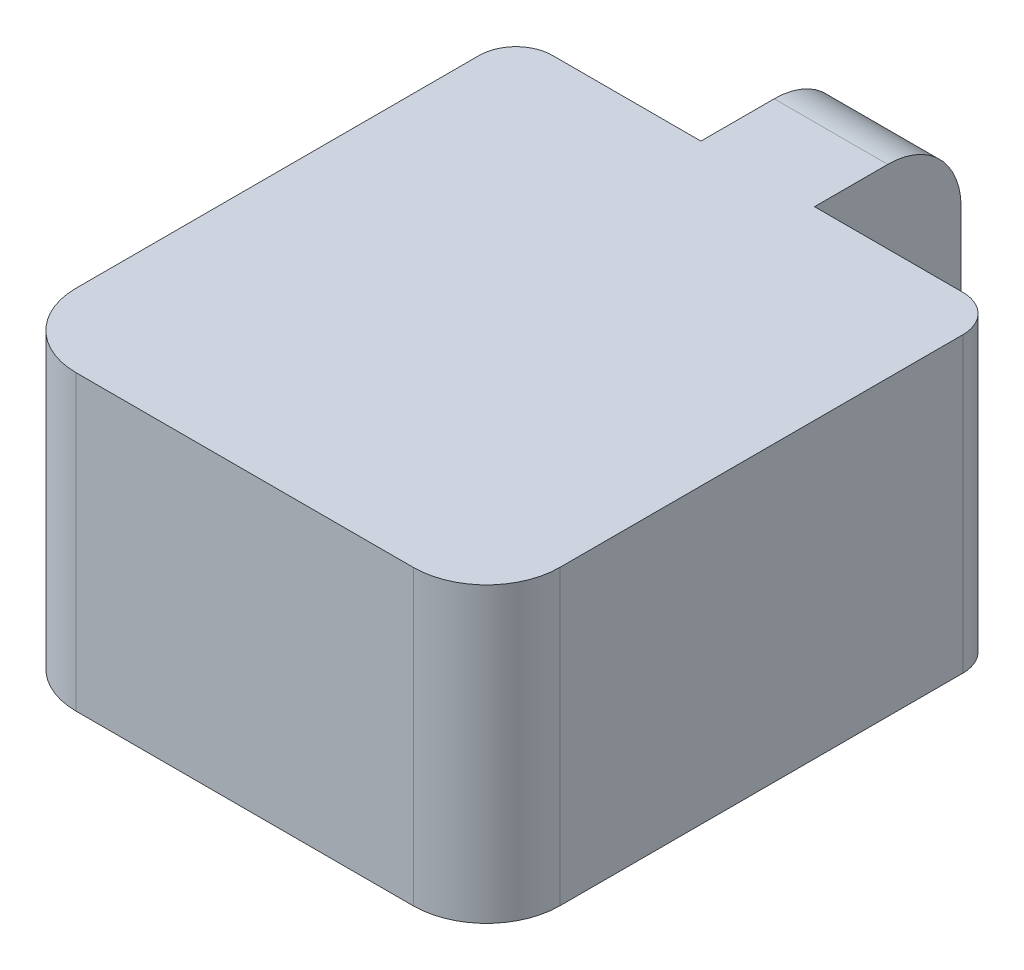
from build123d import *

# Parameters (mm, degrees)
BOSS_EXTRUDE2_DEPTH = 40
FILLET1_R           = 10
FILLET2_R           = 10
FILLET3_R           = 10
SKETCH3_W           = 20
SKETCH3_H           = 10
CUT_EXTRUDE2_DEPTH  = 40
FILLET4_R           = 5
FILLET5_R           = 5
FILLET6_R           = 5
SKETCH2_R           = 5
CUT_EXTRUDE3_DEPTH  = 28


with BuildPart() as part:
    # Sketch1 → Boss-Extrude2 (new body)
    with BuildSketch(Plane(origin=(0, 0, 0), x_dir=(1, 0, 0), z_dir=(0, 1, 0))):
        Polygon((0, 0), (15.5, 0), (15.5, -20), (40.75, -20), (40.75, -90), (-25.25, -90), (-25.25, -20), (0, -20), align=None)
    extrude(amount=BOSS_EXTRUDE2_DEPTH)

    # Fillet1
    fillet1_edges = [part.edges().sort_by_distance(p)[0] for p in [
        (7.75, 40, 0),
    ]]
    fillet(fillet1_edges, radius=FILLET1_R)

    # Fillet2
    fillet2_edges = [part.edges().sort_by_distance(p)[0] for p in [
        (40.75, 20, 90),
    ]]
    fillet(fillet2_edges, radius=FILLET2_R)

    # Fillet3
    fillet3_edges = [part.edges().sort_by_distance(p)[0] for p in [
        (-25.25, 20, 90),
    ]]
    fillet(fillet3_edges, radius=FILLET3_R)

    # Sketch3 → Cut-Extrude2 (cut)
    with BuildSketch(Plane.ZY):
        with Locations((10, 5)):
            Rectangle(SKETCH3_W, SKETCH3_H)
    extrude(amount=-CUT_EXTRUDE2_DEPTH, mode=Mode.SUBTRACT)

    # Fillet4
    fillet4_edges = [part.edges().sort_by_distance(p)[0] for p in [
        (7.75, 10, 0),
    ]]
    fillet(fillet4_edges, radius=FILLET4_R)

    # Fillet5
    fillet5_edges = [part.edges().sort_by_distance(p)[0] for p in [
        (-25.25, 20, 20),
    ]]
    fillet(fillet5_edges, radius=FILLET5_R)

    # Fillet6
    fillet6_edges = [part.edges().sort_by_distance(p)[0] for p in [
        (40.75, 20, 20),
    ]]
    fillet(fillet6_edges, radius=FILLET6_R)

    # Sketch2 → Cut-Extrude3 (cut)
    with BuildSketch(Plane.ZY):
        with Locations((10, 20)):
            Circle(SKETCH2_R)
    extrude(amount=-CUT_EXTRUDE3_DEPTH, mode=Mode.SUBTRACT)


solid = part.part
